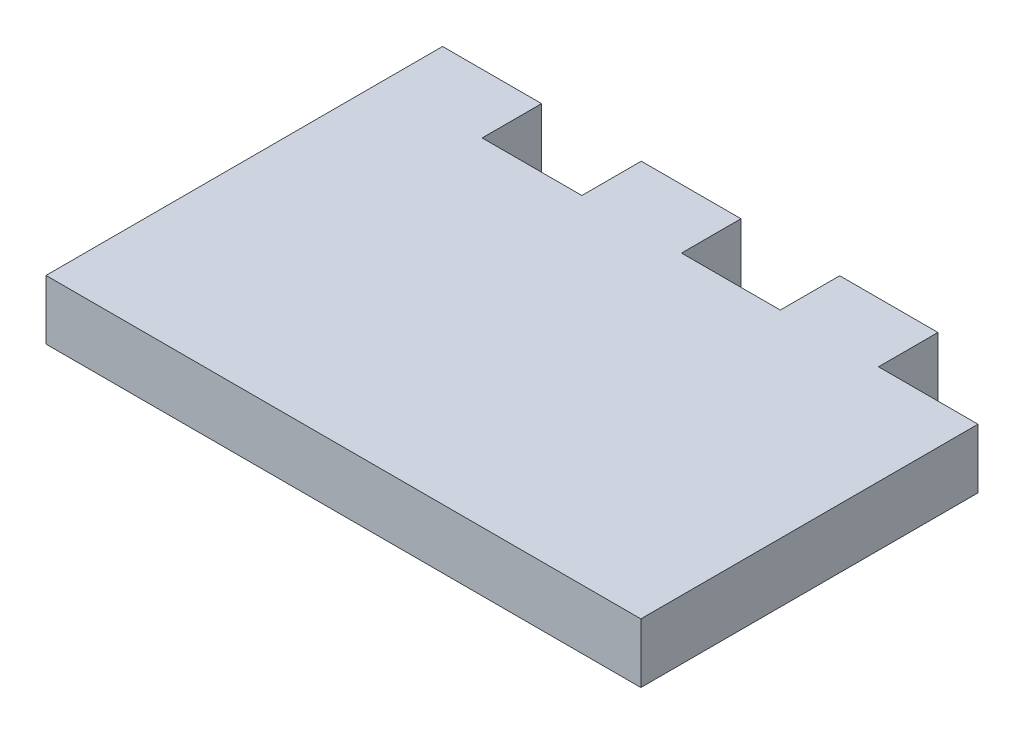
from build123d import *

# Parameters (mm, degrees)
SKETCH1_W           = 30
SKETCH1_H           = 20
BOSS_EXTRUDE1_DEPTH = 3
SKETCH2_W           = 5.028000652
SKETCH2_H           = 2.997589337
SKETCH2_W_2         = 4.978946986
SKETCH2_W_3         = 5.017579195
CUT_EXTRUDE1_DEPTH  = 3


with BuildPart() as part:
    # Sketch1 → Boss-Extrude1 (new body)
    with BuildSketch(Plane(origin=(0, 0, 0), x_dir=(1, 0, 0), z_dir=(0, 1, 0))):
        with Locations((15, 10)):
            Rectangle(SKETCH1_W, SKETCH1_H)
    extrude(amount=BOSS_EXTRUDE1_DEPTH)

    # Sketch2 → Cut-Extrude1 (cut)
    with BuildSketch(Plane(origin=(0, 3, 0), x_dir=(1, 0, 0), z_dir=(0, 1, 0))):
        with Locations((7.507052688, 18.501205332)):
            Rectangle(SKETCH2_W, SKETCH2_H)
        with Locations((17.538527158, 18.501205332)):
            Rectangle(SKETCH2_W_2, SKETCH2_H)
        with Locations((27.491210403, 18.501205332)):
            Rectangle(SKETCH2_W_3, SKETCH2_H)
    extrude(amount=-CUT_EXTRUDE1_DEPTH, mode=Mode.SUBTRACT)


solid = part.part
